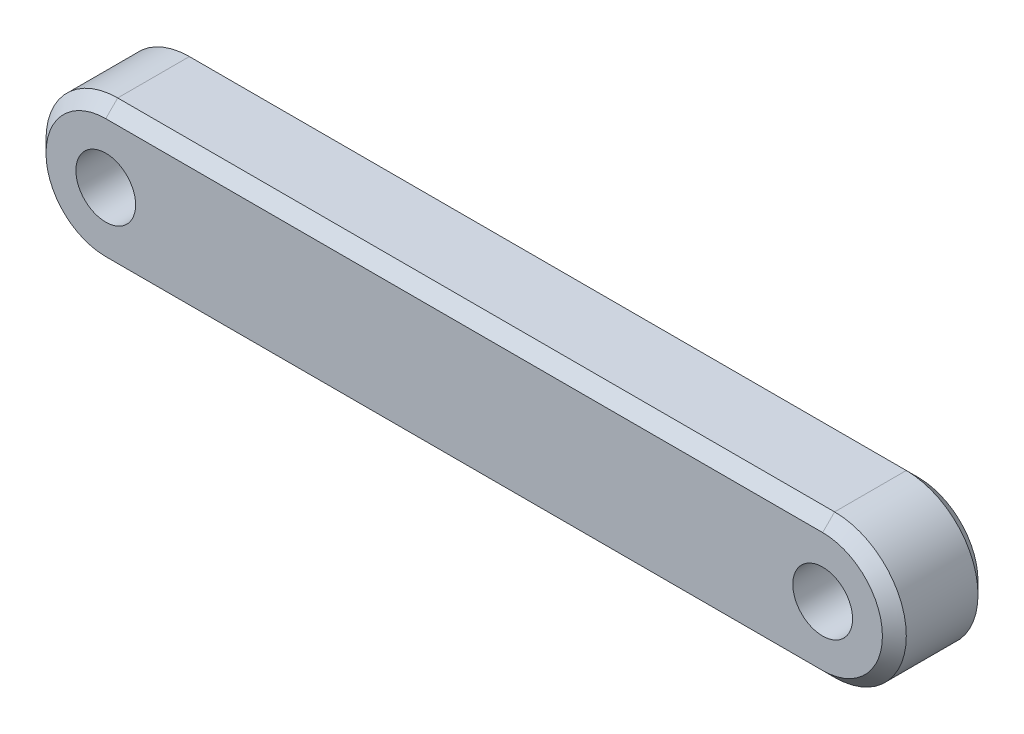
from build123d import *

# Parameters (mm, degrees)
CROQUIS1_R              = 1.25
SALIENTE_EXTRUIR1_DEPTH = 4
CHAFL_N1_SIZE           = 0.5


with BuildPart() as part:
    # Croquis1 → Saliente-Extruir1 (new body)
    with BuildSketch(Plane.XY):
        with BuildLine():
            Line((0, 3), (30, 3))
            ThreePointArc((30, 3), (33, 0), (30, -3))
            Line((30, -3), (0, -3))
            ThreePointArc((0, -3), (-3, 0), (0, 3))
        make_face()
        with Locations((30, 0)):
            Circle(CROQUIS1_R, mode=Mode.SUBTRACT)
        Circle(CROQUIS1_R, mode=Mode.SUBTRACT)
    extrude(amount=SALIENTE_EXTRUIR1_DEPTH)

    # Chaflán1
    chafl_n1_edges = [part.edges().sort_by_distance(p)[0] for p in [
        (33, 0, 4),
        (15, 3, 4),
        (-3, 0, 4),
        (15, 3, 0),
        (33, 0, 0),
        (15, -3, 0),
        (-3, 0, 0),
        (15, -3, 4),
    ]]
    chamfer(chafl_n1_edges, length=CHAFL_N1_SIZE)


solid = part.part
